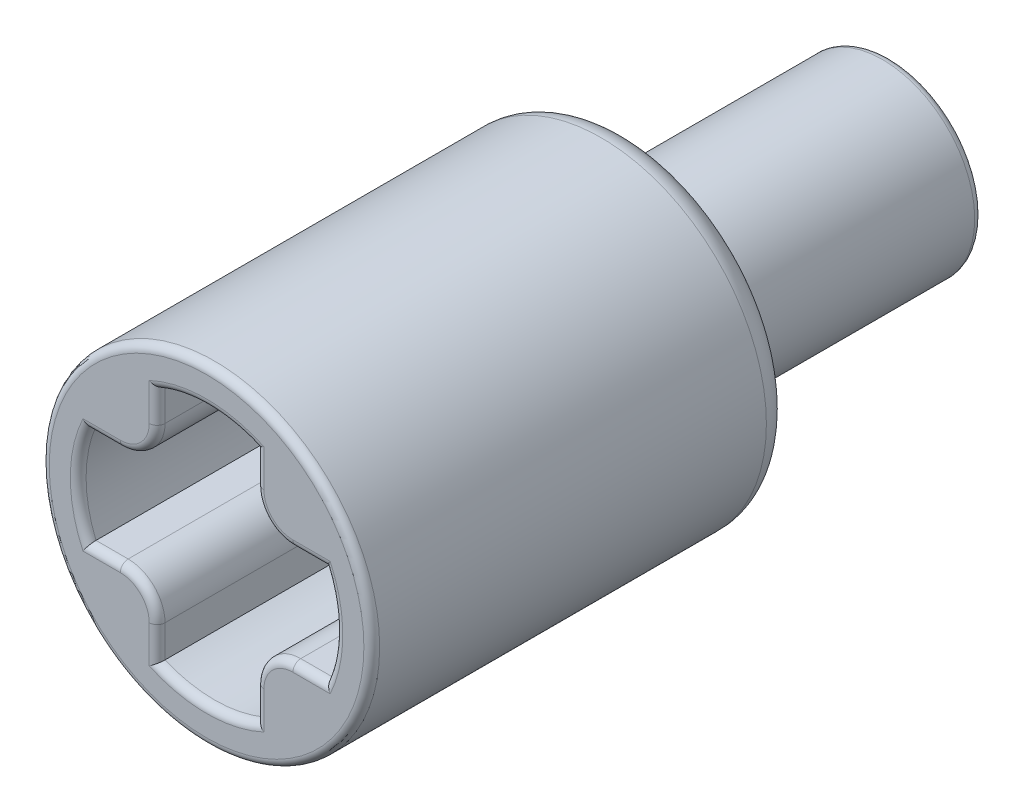
from build123d import *

# Parameters (mm, degrees)
SKETCH1_R           = 1.75
SKETCH1_R_2         = 1
BOSS_EXTRUDE1_DEPTH = 5
SKETCH2_R           = 3.14
SKETCH2_R_2         = 1.75
SKETCH2_R_3         = 1
BOSS_EXTRUDE2_DEPTH = 1
SKETCH2_4_R         = 3.14
BOSS_EXTRUDE3_DEPTH = 8
FILLET1_R           = 0.5
FILLET2_R           = 0.7
FILLET3_R           = 0.15
FILLET4_R           = 0.15


with BuildPart() as part:
    # Sketch1 → Boss-Extrude1 (new body)
    with BuildSketch(Plane.XY):
        Circle(SKETCH1_R)
        Circle(SKETCH1_R_2, mode=Mode.SUBTRACT)
    extrude(amount=BOSS_EXTRUDE1_DEPTH)

    # Sketch2 → Boss-Extrude2 (add)
    # profile 1 of 12: a face of its own
    with BuildSketch(Plane.XY.offset(5)):
        Circle(SKETCH2_R)
        with BuildLine():
            ThreePointArc((-0.94, -2.25166605), (0, -2.44), (0.94, -2.25166605))
            Line((0.94, -2.25166605), (0.94, -0.94))
            Line((0.94, -0.94), (2.25166605, -0.94))
            ThreePointArc((2.25166605, -0.94), (2.44, 0), (2.25166605, 0.94))
            Line((2.25166605, 0.94), (0.94, 0.94))
            Line((0.94, 0.94), (0.94, 2.25166605))
            ThreePointArc((0.94, 2.25166605), (0, 2.44), (-0.94, 2.25166605))
            Line((-0.94, 2.25166605), (-0.94, 0.94))
            Line((-0.94, 0.94), (-2.25166605, 0.94))
            ThreePointArc((-2.25166605, 0.94), (-2.44, 0), (-2.25166605, -0.94))
            Line((-2.25166605, -0.94), (-0.94, -0.94))
            Line((-0.94, -0.94), (-0.94, -2.25166605))
        make_face(mode=Mode.SUBTRACT)
    # profile 2 of 12: a face of its own
    with BuildSketch(Plane.XY.offset(5)):
        Circle(SKETCH2_R_2)
    # profile 3 of 12: a face of its own
    with BuildSketch(Plane.XY.offset(5)):
        with BuildLine():
            Line((-0.94, 0.94), (-0.94, 1.476109752))
            ThreePointArc((-0.94, 1.476109752), (-1.237436867, 1.237436867), (-1.476109752, 0.94))
            Line((-1.476109752, 0.94), (-0.94, 0.94))
        make_face()
    # profile 4 of 12: a face of its own
    with BuildSketch(Plane.XY.offset(5)):
        with BuildLine():
            ThreePointArc((-1.476109752, -0.94), (-1.75, 0), (-1.476109752, 0.94))
            Line((-1.476109752, 0.94), (-2.25166605, 0.94))
            ThreePointArc((-2.25166605, 0.94), (-2.44, 0), (-2.25166605, -0.94))
            Line((-2.25166605, -0.94), (-1.476109752, -0.94))
        make_face()
    # profile 5 of 12: a face of its own
    with BuildSketch(Plane.XY.offset(5)):
        with BuildLine():
            Line((1.476109752, 0.94), (0.94, 0.94))
            Line((0.94, 0.94), (0.94, 1.476109752))
            ThreePointArc((0.94, 1.476109752), (0, 1.75), (-0.94, 1.476109752))
            Line((-0.94, 1.476109752), (-0.94, 0.94))
            Line((-0.94, 0.94), (-1.476109752, 0.94))
            ThreePointArc((-1.476109752, 0.94), (-1.75, 0), (-1.476109752, -0.94))
            Line((-1.476109752, -0.94), (-0.94, -0.94))
            Line((-0.94, -0.94), (-0.94, -1.476109752))
            ThreePointArc((-0.94, -1.476109752), (0, -1.75), (0.94, -1.476109752))
            Line((0.94, -1.476109752), (0.94, -0.94))
            Line((0.94, -0.94), (1.476109752, -0.94))
            ThreePointArc((1.476109752, -0.94), (1.680132743, -0.489544653), (1.75, 0))
            ThreePointArc((1.75, 0), (1.680132743, 0.489544653), (1.476109752, 0.94))
        make_face()
        Circle(SKETCH2_R_3, mode=Mode.SUBTRACT)
    # profile 6 of 12: a face of its own
    with BuildSketch(Plane.XY.offset(5)):
        Circle(SKETCH2_R_3)
    # profile 7 of 12: a face of its own
    with BuildSketch(Plane.XY.offset(5)):
        with BuildLine():
            ThreePointArc((-0.94, 1.476109752), (0, 1.75), (0.94, 1.476109752))
            Line((0.94, 1.476109752), (0.94, 2.25166605))
            ThreePointArc((0.94, 2.25166605), (0, 2.44), (-0.94, 2.25166605))
            Line((-0.94, 2.25166605), (-0.94, 1.476109752))
        make_face()
    # profile 8 of 12: a face of its own
    with BuildSketch(Plane.XY.offset(5)):
        with BuildLine():
            Line((0.94, 1.476109752), (0.94, 0.94))
            Line((0.94, 0.94), (1.476109752, 0.94))
            ThreePointArc((1.476109752, 0.94), (1.237436867, 1.237436867), (0.94, 1.476109752))
        make_face()
    # profile 9 of 12: a face of its own
    with BuildSketch(Plane.XY.offset(5)):
        with BuildLine():
            Line((2.25166605, 0.94), (1.476109752, 0.94))
            ThreePointArc((1.476109752, 0.94), (1.680132743, 0.489544653), (1.75, 0))
            ThreePointArc((1.75, 0), (1.680132743, -0.489544653), (1.476109752, -0.94))
            Line((1.476109752, -0.94), (2.25166605, -0.94))
            ThreePointArc((2.25166605, -0.94), (2.44, 0), (2.25166605, 0.94))
        make_face()
    # profile 10 of 12: a face of its own
    with BuildSketch(Plane.XY.offset(5)):
        with BuildLine():
            ThreePointArc((0.94, -1.476109752), (1.237436867, -1.237436867), (1.476109752, -0.94))
            Line((1.476109752, -0.94), (0.94, -0.94))
            Line((0.94, -0.94), (0.94, -1.476109752))
        make_face()
    # profile 11 of 12: a face of its own
    with BuildSketch(Plane.XY.offset(5)):
        with BuildLine():
            Line((0.94, -2.25166605), (0.94, -1.476109752))
            ThreePointArc((0.94, -1.476109752), (0, -1.75), (-0.94, -1.476109752))
            Line((-0.94, -1.476109752), (-0.94, -2.25166605))
            ThreePointArc((-0.94, -2.25166605), (0, -2.44), (0.94, -2.25166605))
        make_face()
    # profile 12 of 12: a face of its own
    with BuildSketch(Plane.XY.offset(5)):
        with BuildLine():
            Line((-0.94, -0.94), (-1.476109752, -0.94))
            ThreePointArc((-1.476109752, -0.94), (-1.237436867, -1.237436867), (-0.94, -1.476109752))
            Line((-0.94, -1.476109752), (-0.94, -0.94))
        make_face()
    extrude(amount=BOSS_EXTRUDE2_DEPTH)

    # Sketch2<4> → Boss-Extrude3 (add)
    with BuildSketch(Plane.XY.offset(5)):
        Circle(SKETCH2_4_R)
        with BuildLine():
            Line((0.94, 0.94), (2.25166605, 0.94))
            ThreePointArc((2.25166605, 0.94), (2.44, 0), (2.25166605, -0.94))
            Line((2.25166605, -0.94), (0.94, -0.94))
            Line((0.94, -0.94), (0.94, -2.25166605))
            ThreePointArc((0.94, -2.25166605), (0, -2.44), (-0.94, -2.25166605))
            Line((-0.94, -2.25166605), (-0.94, -0.94))
            Line((-0.94, -0.94), (-2.25166605, -0.94))
            ThreePointArc((-2.25166605, -0.94), (-2.44, 0), (-2.25166605, 0.94))
            Line((-2.25166605, 0.94), (-0.94, 0.94))
            Line((-0.94, 0.94), (-0.94, 2.25166605))
            ThreePointArc((-0.94, 2.25166605), (0, 2.44), (0.94, 2.25166605))
            Line((0.94, 2.25166605), (0.94, 0.94))
        make_face(mode=Mode.SUBTRACT)
    extrude(amount=BOSS_EXTRUDE3_DEPTH)

    # Fillet1
    fillet1_edges = [part.edges().sort_by_distance(p)[0] for p in [
        (-3.14, 0, 5),
        (-1.75, 0, 5),
    ]]
    fillet(fillet1_edges, radius=FILLET1_R)

    # Fillet2
    fillet2_edges = [part.edges().sort_by_distance(p)[0] for p in [
        (-0.94, -0.94, 9.5),
        (-0.94, 0.94, 9.5),
        (0.94, 0.94, 9.5),
        (0.94, -0.94, 9.5),
    ]]
    fillet(fillet2_edges, radius=FILLET2_R)

    # Fillet3
    fillet3_edges = [part.edges().sort_by_distance(p)[0] for p in [
        (-1.75, 0, 0),
        (-1, 0, 0),
    ]]
    fillet(fillet3_edges, radius=FILLET3_R)

    # Fillet4
    fillet4_edges = [part.edges().sort_by_distance(p)[0] for p in [
        (1.145025253, -1.145025253, 13),
        (1.145025253, 1.145025253, 13),
        (-1.145025253, 1.145025253, 13),
        (0, -2.44, 13),
        (-2.44, 0, 13),
        (2.44, 0, 13),
        (-0.94, -1.945833025, 13),
        (-1.945833025, 0.94, 13),
        (0, 2.44, 13),
        (1.945833025, -0.94, 13),
        (-3.14, 0, 13),
        (-0.94, 1.945833025, 13),
        (-1.945833025, -0.94, 13),
        (0.94, 1.945833025, 13),
        (1.945833025, 0.94, 13),
        (0.94, -1.945833025, 13),
        (-1.145025253, -1.145025253, 13),
    ]]
    fillet(fillet4_edges, radius=FILLET4_R)


solid = part.part
